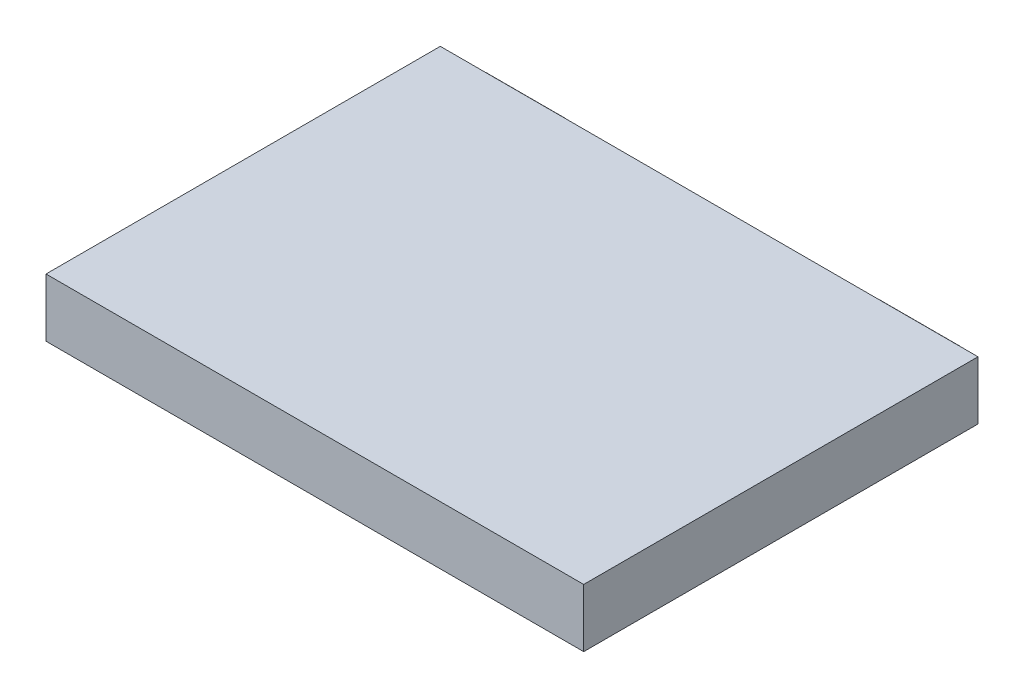
from build123d import *

# Parameters (mm, degrees)
SKETCH1_W           = 120
SKETCH1_H           = 88
BOSS_EXTRUDE1_DEPTH = 13
SKETCH2_W           = 17.753799792
SKETCH2_H           = 6.07366835
BOSS_EXTRUDE2_DEPTH = 3


with BuildPart() as part:
    # Sketch1 → Boss-Extrude1 (new body)
    with BuildSketch(Plane(origin=(0, 0, 0), x_dir=(1, 0, 0), z_dir=(0, 1, 0))):
        Rectangle(SKETCH1_W, SKETCH1_H)
    extrude(amount=BOSS_EXTRUDE1_DEPTH)

    # Sketch2 → Boss-Extrude2 (add)
    with BuildSketch(Plane(origin=(0, 0, -44), x_dir=(-1, 0, 0), z_dir=(0, 0, -1))):
        with Locations((-44, 7)):
            Rectangle(SKETCH2_W, SKETCH2_H)
        with Locations((44, 7)):
            Rectangle(SKETCH2_W, SKETCH2_H)
    extrude(amount=BOSS_EXTRUDE2_DEPTH)


solid = part.part
